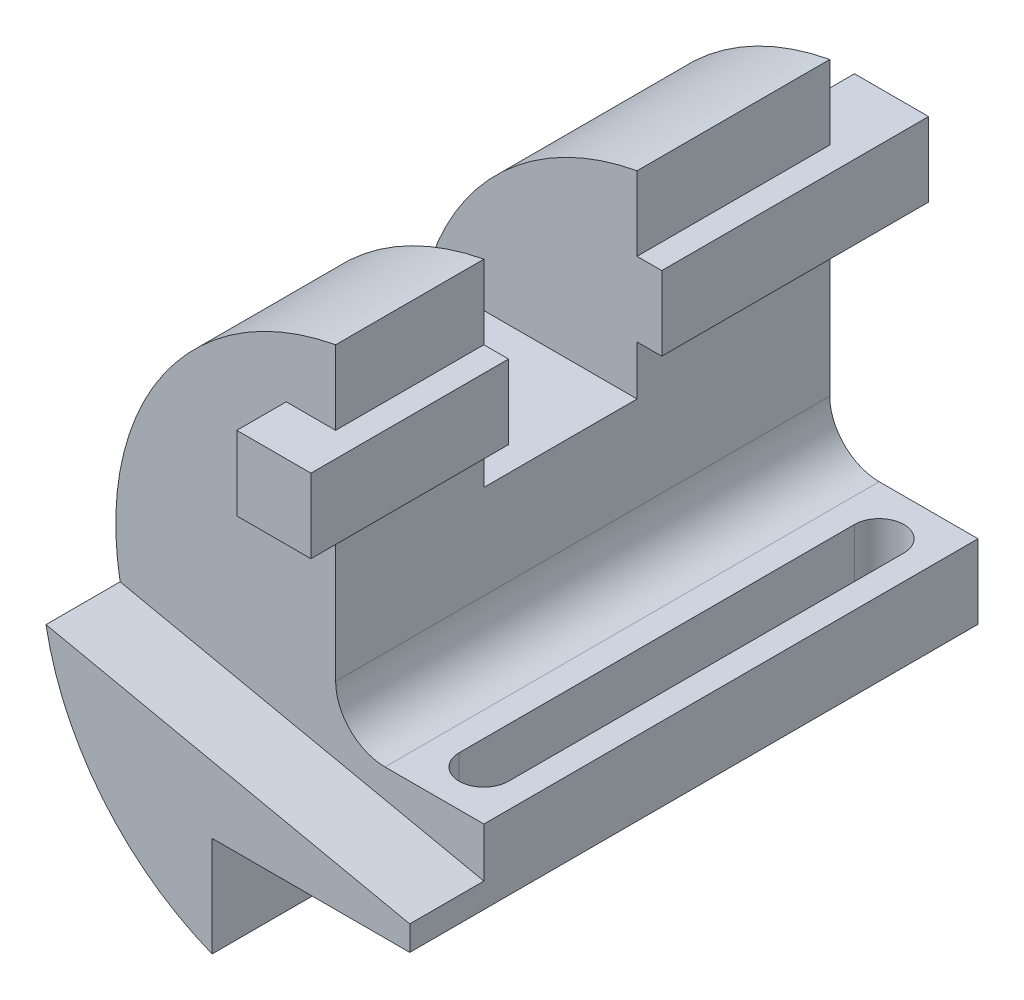
from build123d import *

# Parameters (mm, degrees)
BOSS_EXTRUDE1_DEPTH = 100
BOSS_EXTRUDE2_START = 15
BOSS_EXTRUDE2_DEPTH = 15
SKETCH3_W           = 15
SKETCH3_H           = 15
BOSS_EXTRUDE3_DEPTH = 30
SKETCH4_W           = 15
SKETCH4_H           = 15
BOSS_EXTRUDE4_DEPTH = 10
SKETCH7_W           = 31
SKETCH7_H           = 40
CUT_EXTRUDE2_DEPTH  = 122.862627577
SKETCH8_W           = 15
SKETCH8_H           = 15
BOSS_EXTRUDE5_DEPTH = 39
SKETCH9_W           = 15
SKETCH9_H           = 15
BOSS_EXTRUDE6_DEPTH = 15
CUT_EXTRUDE4_DEPTH  = 145.762736918


with BuildPart() as part:
    # Sketch1 → Boss-Extrude1 (new body)
    with BuildSketch(Plane.XY):
        with BuildLine():
            Line((-10, 53.574714185), (-10, -5.425285815))
            ThreePointArc((-10, -5.425285815), (-7.071067812, -12.496353627), (0, -15.425285815))
            Line((0, -15.425285815), (20, -15.425285815))
            Line((20, -15.425285815), (20, -30.425285815))
            Line((20, -30.425285815), (-20, -30.425285815))
            Line((-20, -30.425285815), (-20, -50.697633081))
            ThreePointArc((-20, -50.697633081), (-54.251088478, 5.202826051), (-10, 53.574714185))
        make_face()
    extrude(amount=-BOSS_EXTRUDE1_DEPTH)

    # Sketch2 → Boss-Extrude2 (add)
    with BuildSketch(Plane.XY.offset(BOSS_EXTRUDE2_START)):
        with BuildLine():
            Line((20, -25.425285815), (20, -30.425285815))
            Line((20, -30.425285815), (-20, -30.425285815))
            Line((-20, -30.425285815), (-20, -50.697633081))
            ThreePointArc((-20, -50.697633081), (-42.112075999, -34.595130511), (-53.615715713, -9.777782398))
            Line((-53.615715713, -9.777782398), (20, -25.425285815))
        make_face()
    extrude(amount=-BOSS_EXTRUDE2_DEPTH)

    # Sketch3 → Boss-Extrude3 (add)
    with BuildSketch(Plane.XY):
        with Locations((-12.5, 31.074714185)):
            Rectangle(SKETCH3_W, SKETCH3_H)
    extrude(amount=-BOSS_EXTRUDE3_DEPTH)

    # Sketch4 → Boss-Extrude4 (add)
    with BuildSketch(Plane.XY):
        with Locations((-12.5, 31.074714185)):
            Rectangle(SKETCH4_W, SKETCH4_H)
    extrude(amount=BOSS_EXTRUDE4_DEPTH)

    # Sketch7 → Cut-Extrude2 (cut, through all)
    with BuildSketch(Plane(origin=(-10, 0, 0), x_dir=(0, 0, -1), z_dir=(1, 0, 0))):
        with Locations((45.5, 33.574714185)):
            Rectangle(SKETCH7_W, SKETCH7_H)
    extrude(amount=-CUT_EXTRUDE2_DEPTH, mode=Mode.SUBTRACT)

    # Sketch8 → Boss-Extrude5 (add)
    with BuildSketch(Plane(origin=(0, 0, -100), x_dir=(-1, 0, 0), z_dir=(0, 0, -1))):
        with Locations((12.5, 31.074714185)):
            Rectangle(SKETCH8_W, SKETCH8_H)
    extrude(amount=-BOSS_EXTRUDE5_DEPTH)

    # Sketch9 → Boss-Extrude6 (add)
    with BuildSketch(Plane(origin=(0, 0, -100), x_dir=(-1, 0, 0), z_dir=(0, 0, -1))):
        with Locations((12.5, 31.074714185)):
            Rectangle(SKETCH9_W, SKETCH9_H)
    extrude(amount=BOSS_EXTRUDE6_DEPTH)

    # Sketch10 → Cut-Extrude4 (cut, through all)
    with BuildSketch(Plane(origin=(0, -15.425285815, 0), x_dir=(1, 0, 0), z_dir=(0, 1, 0))):
        with BuildLine():
            Line((5, 10), (5, 90))
            ThreePointArc((5, 90), (10, 95), (15, 90))
            Line((15, 90), (15, 10))
            ThreePointArc((15, 10), (10, 5), (5, 10))
        make_face()
    extrude(amount=-CUT_EXTRUDE4_DEPTH, mode=Mode.SUBTRACT)


solid = part.part
